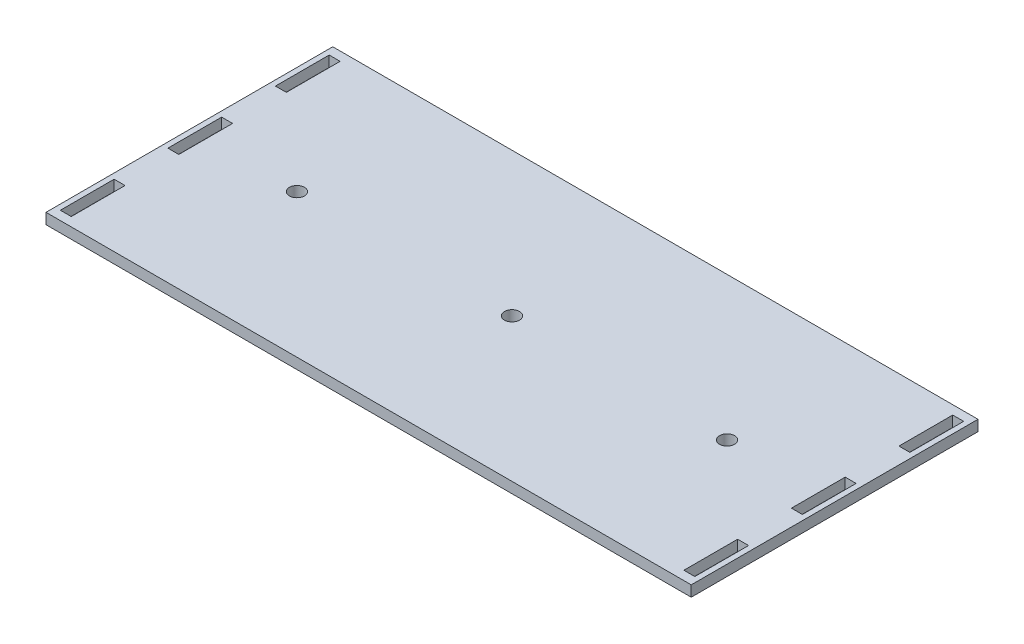
from build123d import *

# Parameters (mm, degrees)
SKETCH_1_W      = 180
SKETCH_1_H      = 80
SKETCH_1_R      = 2.1
SKETCH_1_W_2    = 3.05
SKETCH_1_H_2    = 15
EXTRUDE_1_DEPTH = 3


with BuildPart() as part:
    # 草图1 → 凸台-拉伸1 (new body)
    with BuildSketch(Plane(origin=(0, 0, 0), x_dir=(1, 0, 0), z_dir=(0, 1, 0))):
        Rectangle(SKETCH_1_W, SKETCH_1_H)
        with Locations(Location((-60, 0, 0), (0, 0, 270))):
            Circle(SKETCH_1_R, mode=Mode.SUBTRACT)
        with Locations(Location((0, 0, 0), (0, 0, 270))):
            Circle(SKETCH_1_R, mode=Mode.SUBTRACT)
        with Locations(Location((60, 0, 0), (0, 0, 270))):
            Circle(SKETCH_1_R, mode=Mode.SUBTRACT)
        with Locations((-86.975, 30)):
            Rectangle(SKETCH_1_W_2, SKETCH_1_H_2, mode=Mode.SUBTRACT)
        with Locations((-86.975, 0)):
            Rectangle(SKETCH_1_W_2, SKETCH_1_H_2, mode=Mode.SUBTRACT)
        with Locations((-86.975, -30)):
            Rectangle(SKETCH_1_W_2, SKETCH_1_H_2, mode=Mode.SUBTRACT)
        with Locations((86.975, 30)):
            Rectangle(SKETCH_1_W_2, SKETCH_1_H_2, mode=Mode.SUBTRACT)
        with Locations((86.975, -30)):
            Rectangle(SKETCH_1_W_2, SKETCH_1_H_2, mode=Mode.SUBTRACT)
        with Locations((86.975, 0)):
            Rectangle(SKETCH_1_W_2, SKETCH_1_H_2, mode=Mode.SUBTRACT)
    extrude(amount=EXTRUDE_1_DEPTH)


solid = part.part
